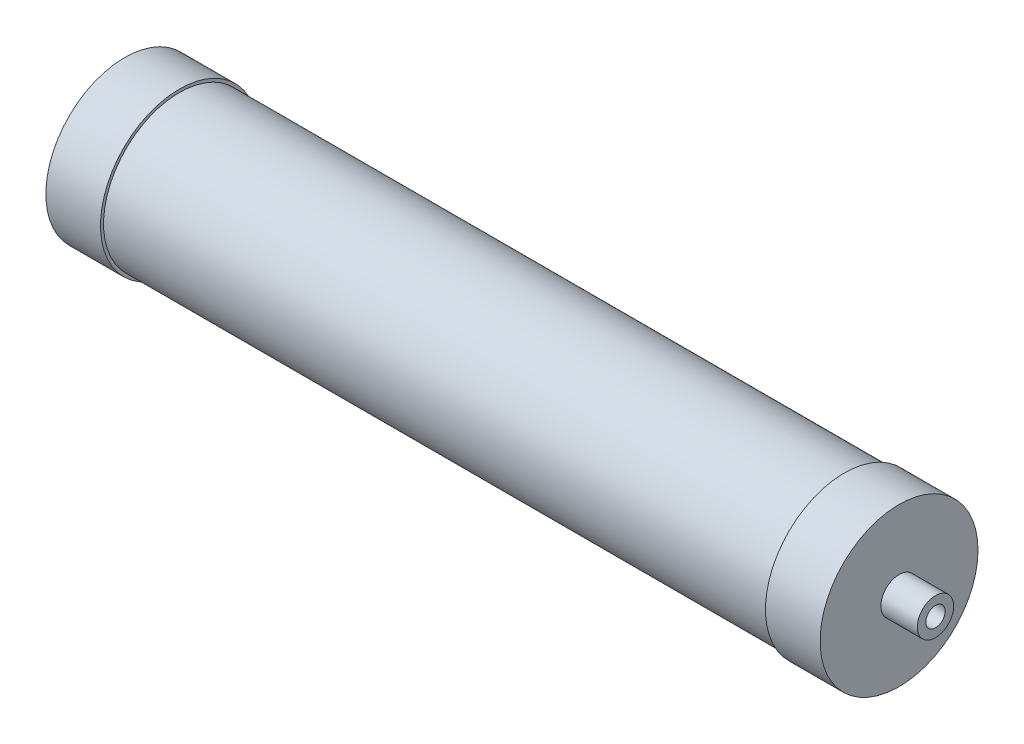
from build123d import *

# Parameters (mm, degrees)
BODY_START          = -127.5
SKETCH1_R           = 25
BODY_DEPTH          = 255
END_CAP_IN_START    = -127.5
SKETCH2_R           = 26
END_CAP_IN_DEPTH    = 18
END_CAP_OUT_START   = 109.5
SKETCH3_R           = 26
END_CAP_OUT_DEPTH   = 18
INLET_PORT_START    = -139.5
SKETCH4_R           = 6
INLET_PORT_DEPTH    = 12
INLET_SOCKET_START  = -139.5
SKETCH5_R           = 3.2
INLET_SOCKET_DEPTH  = 10
OUTLET_PORT_START   = 127.5
SKETCH6_R           = 6
OUTLET_PORT_DEPTH   = 12
OUTLET_SOCKET_START = 129.5
SKETCH7_R           = 3.2
OUTLET_SOCKET_DEPTH = 10


with BuildPart() as part:
    # Sketch1 → Body (new body)
    with BuildSketch(Plane(origin=(0, 0, 0), x_dir=(0, 0, -1), z_dir=(1, 0, 0)).offset(BODY_START)):
        Circle(SKETCH1_R)
    extrude(amount=BODY_DEPTH)

    # Sketch2 → End_Cap_In (add)
    with BuildSketch(Plane(origin=(0, 0, 0), x_dir=(0, 0, -1), z_dir=(1, 0, 0)).offset(END_CAP_IN_START)):
        Circle(SKETCH2_R)
    extrude(amount=END_CAP_IN_DEPTH)

    # Sketch3 → End_Cap_Out (add)
    with BuildSketch(Plane(origin=(0, 0, 0), x_dir=(0, 0, -1), z_dir=(1, 0, 0)).offset(END_CAP_OUT_START)):
        Circle(SKETCH3_R)
    extrude(amount=END_CAP_OUT_DEPTH)

    # Sketch4 → Inlet_Port (add)
    with BuildSketch(Plane(origin=(0, 0, 0), x_dir=(0, 0, -1), z_dir=(1, 0, 0)).offset(INLET_PORT_START)):
        Circle(SKETCH4_R)
    extrude(amount=INLET_PORT_DEPTH)

    # Sketch5 → Inlet_Socket (cut)
    with BuildSketch(Plane(origin=(0, 0, 0), x_dir=(0, 0, -1), z_dir=(1, 0, 0)).offset(INLET_SOCKET_START)):
        Circle(SKETCH5_R)
    extrude(amount=INLET_SOCKET_DEPTH, mode=Mode.SUBTRACT)

    # Sketch6 → Outlet_Port (add)
    with BuildSketch(Plane(origin=(0, 0, 0), x_dir=(0, 0, -1), z_dir=(1, 0, 0)).offset(OUTLET_PORT_START)):
        Circle(SKETCH6_R)
    extrude(amount=OUTLET_PORT_DEPTH)

    # Sketch7 → Outlet_Socket (cut)
    with BuildSketch(Plane(origin=(0, 0, 0), x_dir=(0, 0, -1), z_dir=(1, 0, 0)).offset(OUTLET_SOCKET_START)):
        Circle(SKETCH7_R)
    extrude(amount=OUTLET_SOCKET_DEPTH, mode=Mode.SUBTRACT)


solid = part.part
